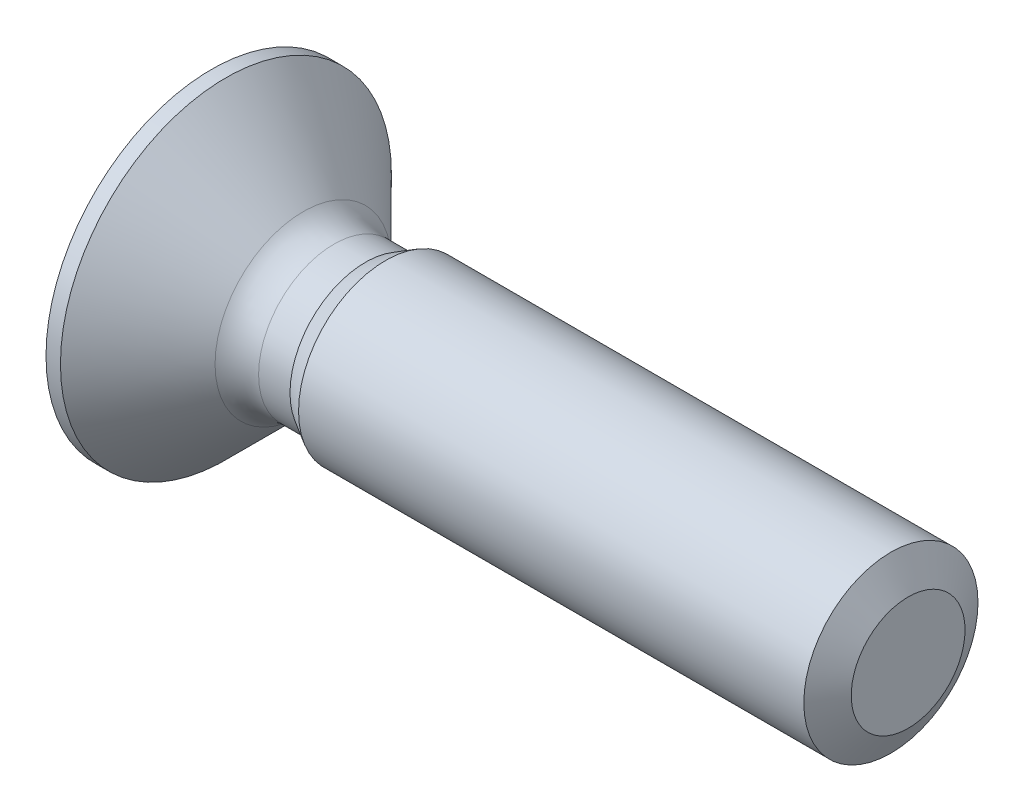
from build123d import *

# Parameters (mm, degrees)
PATTERN_CIRCULAR_1_COUNT = 2
PATTERN_CIRCULAR_1_ANGLE = 90


with BuildPart() as part:
    # 草图1 → Revolve 694 (revolve)
    with BuildSketch(Plane.XY, mode=Mode.PRIVATE) as revolve_694_sk:
        with BuildLine():
            Line((0, 0), (0, 1.9))
            Line((0, 1.9), (0.166, 1.9))
            Line((0.166, 1.9), (1.053553391, 1.012446609))
            ThreePointArc((1.053553391, 1.012446609), (1.215765065, 0.904060234), (1.407106781, 0.866))
            Line((1.407106781, 0.866), (1.767905192, 0.866))
            Line((1.767905192, 0.866), (2, 1))
            Line((2, 1), (8, 1))
            Line((8, 1), (8, 0))
            Line((8, 0), (0, 0))
        make_face()
    revolve(revolve_694_sk.sketch.rotate(Axis((0, 0, 0), (1, 0, 0)), 90), axis=Axis((0, 0, 0), (1, 0, 0)))

    # 草图2 → 切除-旋转1 (revolve, cut)
    with BuildSketch(Plane.XY, mode=Mode.PRIVATE) as cut_revolve_1_sk:
        Polygon((7.802166402, 1), (8.202166402, 1), (8, 0.6536), align=None)
    revolve(cut_revolve_1_sk.sketch.rotate(Axis((0, 0, 0), (-1, 0, 0)), 270), axis=Axis((0, 0, 0), (-1, 0, 0)), mode=Mode.SUBTRACT)

    # 草图3 → 切除-放样1 section 0
    with BuildSketch(Plane.ZY, mode=Mode.PRIVATE) as loft_1_s0:
        with BuildLine():
            Line((-0.95, 0.2), (0.95, 0.2))
            Line((0.95, 0.2), (0.95, -0.2))
            Line((0.95, -0.2), (-0.95, -0.2))
            Line((-0.95, -0.2), (-0.95, 0.2))
        make_face()
    loft_1 = loft([loft_1_s0.sketch, Vertex(1.2, 0, 0)], mode=Mode.SUBTRACT)

    # 阵列(圆周)1: 切除-放样1 ×2 about axis
    pattern_circular_1_axis = Axis((0, 0, 0), (1, 0, 0))
    for i in range(1, PATTERN_CIRCULAR_1_COUNT):
        add(loft_1.rotate(pattern_circular_1_axis, i * PATTERN_CIRCULAR_1_ANGLE / (PATTERN_CIRCULAR_1_COUNT - 1)), mode=Mode.SUBTRACT)


solid = part.part
